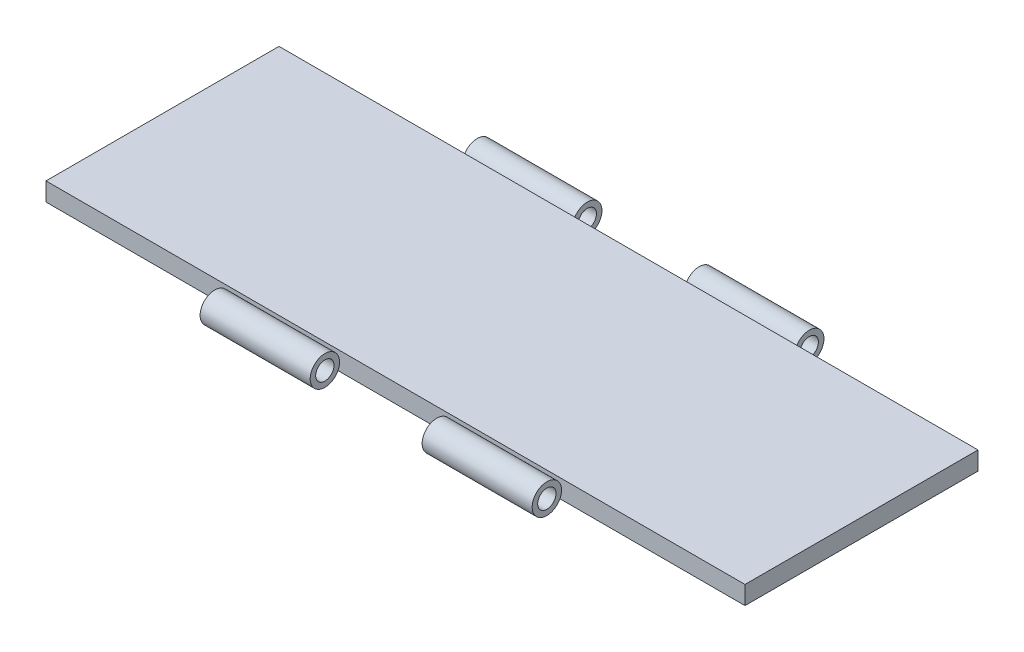
from build123d import *

# Parameters (mm, degrees)
CROQUIS1_W                 = 76.2
CROQUIS1_H                 = 25.4
SALIENTE_EXTRUIR1_DEPTH    = 2
CROQUIS2_R                 = 1.6
SALIENTE_EXTRUIR2_DEPTH    = 76.2
SALIENTE_EXTRUIR2_2_DEPTH  = 76.2
CROQUIS4_R                 = 1
CORTAR_EXTRUIR2_DEPTH      = 76.2
CORTAR_EXTRUIR6_DEPTH      = 42.375126825
CORTAR_EXTRUIR6_DEPTH_BACK = 42.375126825
CROQUIS5_W                 = 20
CROQUIS5_H                 = 3.21236059
CROQUIS5_H_2               = 3.2
CROQUIS5_W_2               = 12.2


with BuildPart() as part:
    # Croquis1 → Saliente-Extruir1 (new body)
    with BuildSketch(Plane(origin=(0, 0, 0), x_dir=(1, 0, 0), z_dir=(0, 1, 0))):
        Rectangle(CROQUIS1_W, CROQUIS1_H)
    extrude(amount=SALIENTE_EXTRUIR1_DEPTH)


with BuildPart() as body_2:
    # Croquis2 → Saliente-Extruir2 (new body)
    with BuildSketch(Plane.ZY.offset(38.1)):
        with Locations((-14.306180295, 0.901009784)):
            Circle(CROQUIS2_R)
    extrude(amount=-SALIENTE_EXTRUIR2_DEPTH)


with BuildPart() as body_3:
    # Croquis2 → Saliente-Extruir2 2 (new body)
    with BuildSketch(Plane.ZY.offset(38.1)):
        with Locations((14.3, 0.901009784)):
            Circle(CROQUIS2_R)
    extrude(amount=-SALIENTE_EXTRUIR2_2_DEPTH)


with BuildPart() as cortar_extruir2_tool:
    # Croquis4 → Cortar-Extruir2 (new body)
    with BuildSketch(Plane.ZY.offset(38.1)):
        with Locations((-14.306180295, 0.901009784)):
            Circle(CROQUIS4_R)
        with Locations((14.3, 0.901009784)):
            Circle(CROQUIS4_R)
    extrude(amount=-CORTAR_EXTRUIR2_DEPTH)


with BuildPart() as body_2_1:
    add(body_2.part)

    # Cortar-Extruir2: cut by cortar_extruir2_tool
    add(cortar_extruir2_tool.part, mode=Mode.SUBTRACT)


with BuildPart() as body_3_1:
    add(body_3.part)

    # Cortar-Extruir2: cut by cortar_extruir2_tool
    add(cortar_extruir2_tool.part, mode=Mode.SUBTRACT)


with BuildPart() as cortar_extruir6_tool:
    # Croquis5 → Cortar-Extruir6 (new, two sides: drawn at the far end of the back side and taken through both)
    with BuildSketch(Plane(origin=(0, 2, 0), x_dir=(1, 0, 0), z_dir=(0, 1, 0)).offset(-CORTAR_EXTRUIR6_DEPTH_BACK)):
        with Locations((-28.1, 14.306180295)):
            Rectangle(CROQUIS5_W, CROQUIS5_H)
        with Locations((28.1, 14.306180295)):
            Rectangle(CROQUIS5_W, CROQUIS5_H_2)
        with Locations((0, 14.306180295)):
            Rectangle(CROQUIS5_W_2, CROQUIS5_H_2)
        with Locations((-28.1, -14.3)):
            Rectangle(CROQUIS5_W, CROQUIS5_H_2)
        with Locations((0, -14.3)):
            Rectangle(CROQUIS5_W_2, CROQUIS5_H_2)
        with Locations((28.1, -14.3)):
            Rectangle(CROQUIS5_W, CROQUIS5_H_2)
    extrude(amount=CORTAR_EXTRUIR6_DEPTH + CORTAR_EXTRUIR6_DEPTH_BACK)


with BuildPart() as body_2_2:
    add(body_2_1.part)

    # Cortar-Extruir6: cut by cortar_extruir6_tool
    add(cortar_extruir6_tool.part, mode=Mode.SUBTRACT)


with BuildPart() as body_3_2:
    add(body_3_1.part)

    # Cortar-Extruir6: cut by cortar_extruir6_tool
    add(cortar_extruir6_tool.part, mode=Mode.SUBTRACT)


with BuildPart() as cortar_extruir6_piece_1:
    # of the separate pieces the step leaves, piece 1, a body of its own (cortar_extruir6_pieces)
    add(body_2_2.part.solids().sort_by_distance((6.1, 0.901009784, -12.706180295))[0])


with BuildPart() as cortar_extruir6_piece_2:
    # of the separate pieces the step leaves, piece 2, a body of its own (cortar_extruir6_pieces)
    add(body_2_2.part.solids().sort_by_distance((-6.1, 0.901009784, -12.706180295))[0])


with BuildPart() as cortar_extruir6_piece_1_of_body_3:
    # of the separate pieces the step leaves, piece 1, a body of its own (cortar_extruir6_pieces_of_body_3)
    add(body_3_2.part.solids().sort_by_distance((6.1, 0.901009784, 15.9))[0])


with BuildPart() as cortar_extruir6_piece_2_of_body_3:
    # of the separate pieces the step leaves, piece 2, a body of its own (cortar_extruir6_pieces_of_body_3)
    add(body_3_2.part.solids().sort_by_distance((-18.1, 0.901009784, 15.9))[0])


solid = Compound([part.part, cortar_extruir6_piece_1.part, cortar_extruir6_piece_2.part, cortar_extruir6_piece_1_of_body_3.part, cortar_extruir6_piece_2_of_body_3.part])
